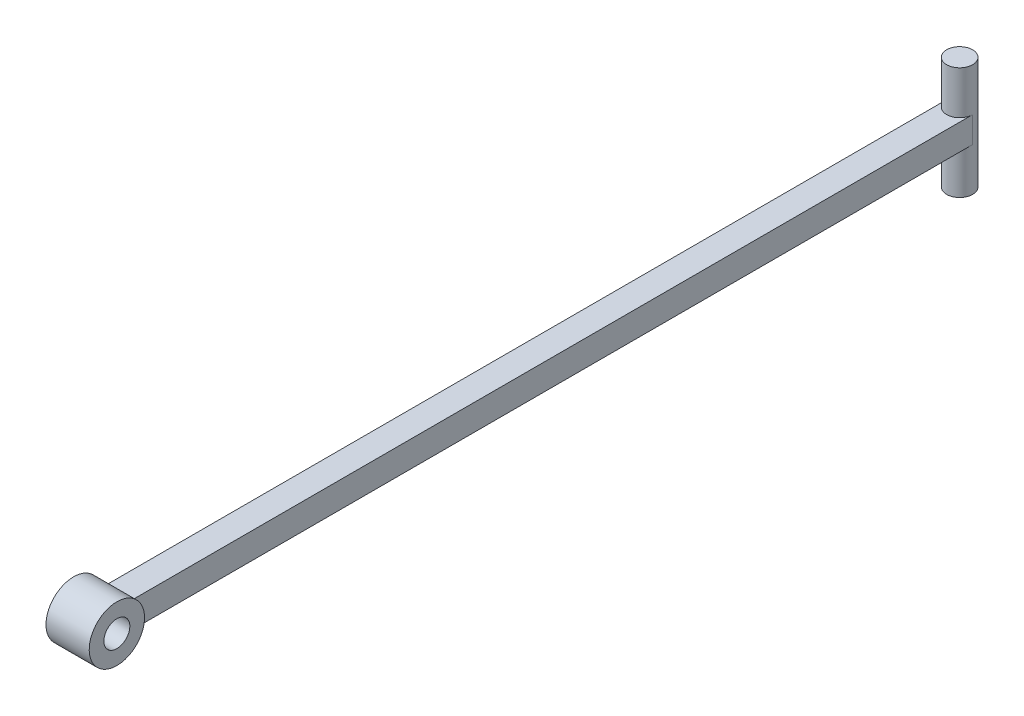
from build123d import *

# Parameters (mm, degrees)
SKETCH1_W                = 60
SKETCH1_H                = 60
BOSS_EXTRUDE1_DEPTH      = 2000
BOSS_EXTRUDE2_DEPTH      = 100
BOSS_EXTRUDE2_DEPTH_BACK = 160
SKETCH2_R                = 30
BOSS_EXTRUDE3_DEPTH      = 20
BOSS_EXTRUDE3_DEPTH_BACK = 80
SKETCH3_R                = 64
SKETCH3_R_2              = 30
SKETCH4_R                = 30
CUT_EXTRUDE1_DEPTH       = 360


with BuildPart() as part:
    # Sketch1 → Boss-Extrude1 (new body)
    with BuildSketch(Plane.XY):
        with Locations((30, -30)):
            Rectangle(SKETCH1_W, SKETCH1_H)
    extrude(amount=BOSS_EXTRUDE1_DEPTH)

    # Sketch2 → Boss-Extrude2 (add, two sides: drawn at the far end of the back side and taken through both)
    with BuildSketch(Plane(origin=(0, 0, 0), x_dir=(1, 0, 0), z_dir=(0, 1, 0)).offset(-BOSS_EXTRUDE2_DEPTH_BACK)):
        with Locations(Location((30, 0, 0), (0, 0, 270))):
            Circle(SKETCH2_R)
    extrude(amount=BOSS_EXTRUDE2_DEPTH + BOSS_EXTRUDE2_DEPTH_BACK)

    # Sketch3 → Boss-Extrude3 (add, two sides: drawn at the far end of the back side and taken through both)
    with BuildSketch(Plane(origin=(60, 0, 0), x_dir=(0, 0, -1), z_dir=(1, 0, 0)).offset(-BOSS_EXTRUDE3_DEPTH_BACK)):
        with Locations(Location((-2000, -30, 0), (0, 0, 90))):
            Circle(SKETCH3_R)
        with Locations(Location((-2000, -30, 0), (0, 0, 90))):
            Circle(SKETCH3_R_2, mode=Mode.SUBTRACT)
    extrude(amount=BOSS_EXTRUDE3_DEPTH + BOSS_EXTRUDE3_DEPTH_BACK)

    # Sketch4 → Cut-Extrude1 (cut)
    with BuildSketch(Plane(origin=(80, 0, 0), x_dir=(0, 0, -1), z_dir=(1, 0, 0))):
        with Locations(Location((-2000, -30, 0), (0, 0, 90))):
            Circle(SKETCH4_R)
    extrude(amount=-CUT_EXTRUDE1_DEPTH, mode=Mode.SUBTRACT)


solid = part.part
